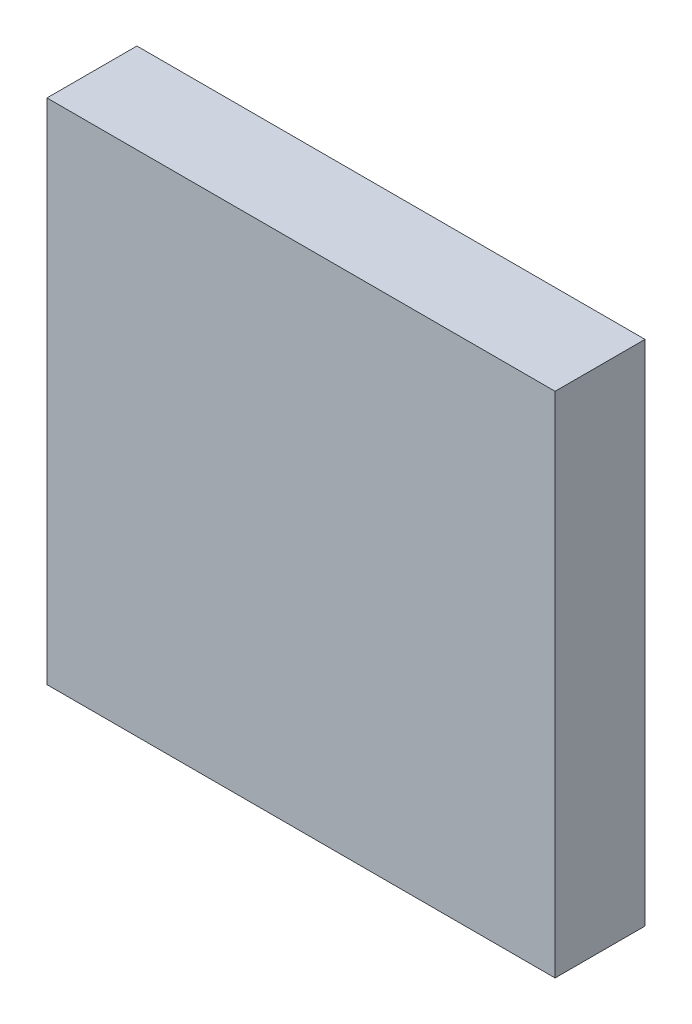
from build123d import *

# Parameters (mm, degrees)
SKETCH1_W           = 113
SKETCH1_H           = 113
BOSS_EXTRUDE1_DEPTH = 20


with BuildPart() as part:
    # Sketch1 → Boss-Extrude1 (new body)
    with BuildSketch(Plane.XY):
        Rectangle(SKETCH1_W, SKETCH1_H)
    extrude(amount=BOSS_EXTRUDE1_DEPTH)


solid = part.part
